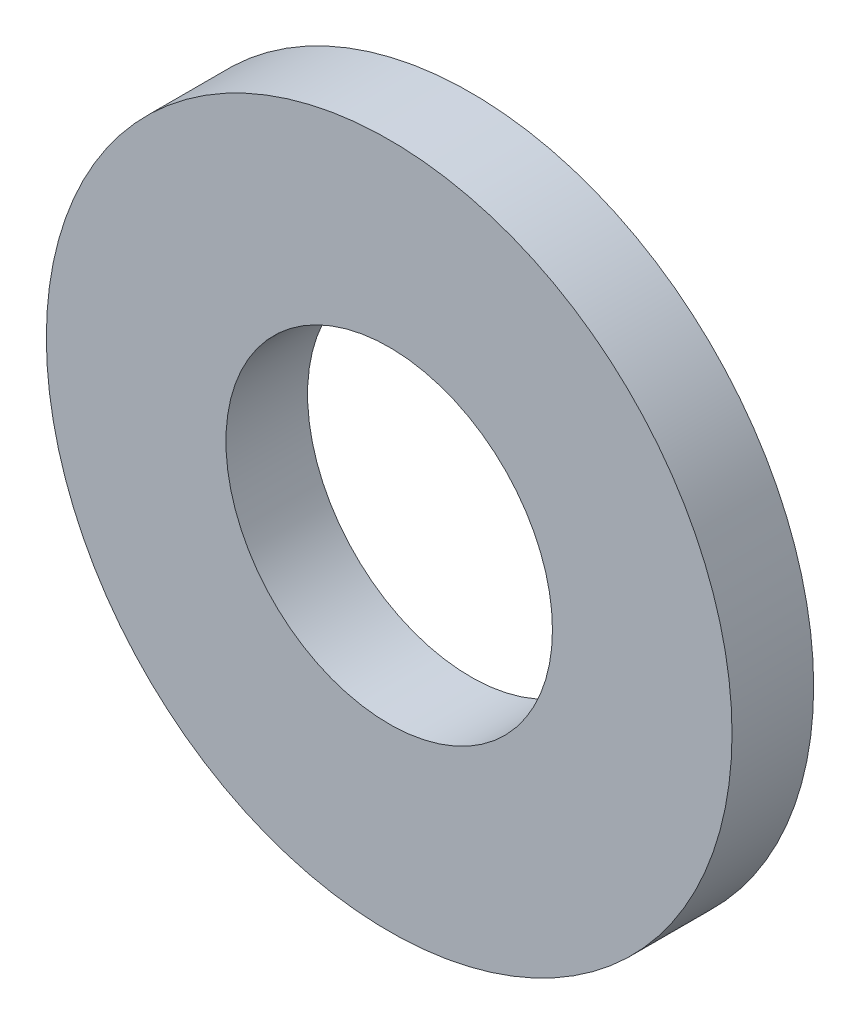
from build123d import *

# Parameters (mm, degrees)
SKETCH1_R           = 10.5
SKETCH1_R_2         = 5
BOSS_EXTRUDE1_DEPTH = 2.5


with BuildPart() as part:
    # Sketch1 → Boss-Extrude1 (new body)
    with BuildSketch(Plane.XY):
        Circle(SKETCH1_R)
        Circle(SKETCH1_R_2, mode=Mode.SUBTRACT)
    extrude(amount=BOSS_EXTRUDE1_DEPTH)


solid = part.part
